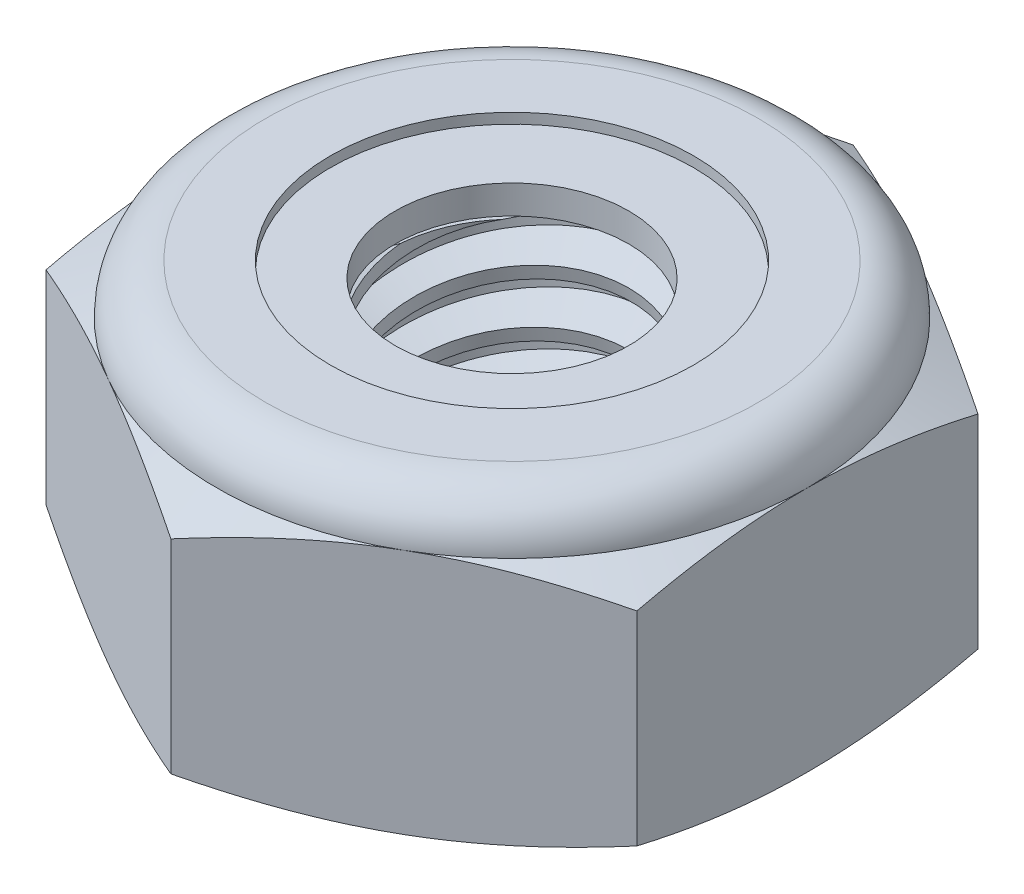
from build123d import *

# Parameters (mm, degrees)
EXTRUDE1_DEPTH       = 4.365625
SKETCH2_W            = 2.0828
SKETCH2_H            = 4.365625
LPATTERN1_COUNT      = 6
LPATTERN1_PITCH      = 0.79375
LPATTERN1_COUNT_DIR2 = 2
LPATTERN1_PITCH_DIR2 = 0.79375


with BuildPart() as part:
    # Sketch1 → Extrude1 (new body)
    with BuildSketch(Plane(origin=(0, 0, 0), x_dir=(1, 0, 0), z_dir=(0, 1, 0))):
        Polygon((0, 5.040989538), (-4.365625, 2.520494769), (-4.365625, -2.520494769), (0, -5.040989538), (4.365625, -2.520494769), (4.365625, 2.520494769), align=None)
    extrude(amount=EXTRUDE1_DEPTH)

    # Sketch4 → Cut-Revolve2 (revolve, cut)
    with BuildSketch(Plane(origin=(0, 0, 0), x_dir=(0, 0, -1), z_dir=(1, 0, 0))):
        Polygon((0, 4.365625), (2.0828, 4.365625), (1.725765218, 4.199136947), (1.725765218, 0.166488053), (2.0828, 0), (0, 0), align=None)
    revolve(axis=Axis((0, 4.365625, 0), (0, 1, 0)), mode=Mode.SUBTRACT)


with BuildPart() as body_2:
    # Sketch2 → Revolve1 (revolve)
    with BuildSketch(Plane(origin=(0, 0, 0), x_dir=(0, 0, -1), z_dir=(1, 0, 0))):
        with Locations((1.0414, 2.1828125)):
            Rectangle(SKETCH2_W, SKETCH2_H)
    revolve(axis=Axis((0, -2.0828, 0), (0, 1, 0)))

    # Sketch3 → Cut-Revolve1 (revolve, cut)
    with BuildSketch(Plane(origin=(0, 0, 0), x_dir=(0, 0, -1), z_dir=(1, 0, 0))):
        Polygon((2.101371857, 4.268159896), (2.231374854, 3.585904168), (1.762908932, 3.74914843), (1.725765218, 3.944078638), align=None)
    cut_revolve1 = revolve(axis=Axis((0, 4.365625, 0.162231854), (0, -0.9823254572523517, -0.18718091792156105)), mode=Mode.SUBTRACT)

    # LPattern1: Cut-Revolve1 6 × 2
    with Locations(*[Vector(0, -1, 0) * (i * LPATTERN1_PITCH) + Vector(0, 1, 0) * (j * LPATTERN1_PITCH_DIR2) for i in range(LPATTERN1_COUNT) for j in range(LPATTERN1_COUNT_DIR2) if (i, j) != (0, 0)]):
        add(cut_revolve1, mode=Mode.SUBTRACT)


with BuildPart() as part_1:
    add(part.part)

    # Combine1: cut body 2
    add(body_2.part, mode=Mode.SUBTRACT)

    # Sketch5 → Cut-Revolve3 (revolve, cut)
    with BuildSketch(Plane(origin=(0, 0, 0), x_dir=(0, 0, -1), z_dir=(1, 0, 0))):
        with BuildLine():
            Line((0, 0), (4.365625, 0))
            Line((4.365625, 0), (5.040989538, 0.314927656))
            Line((5.040989538, 0.314927656), (5.040989538, 3.323093177))
            Line((5.040989538, 3.323093177), (4.365625, 3.638020833))
            ThreePointArc((4.365625, 3.638020833), (4.152514674, 4.152514674), (3.638020833, 4.365625))
            Line((3.638020833, 4.365625), (3.638020833, 5.635625))
            Line((3.638020833, 5.635625), (6.310989538, 5.635625))
            Line((6.310989538, 5.635625), (6.310989538, -1.27))
            Line((6.310989538, -1.27), (0, -1.27))
            Line((0, -1.27), (0, 0))
        make_face()
    revolve(axis=Axis((0, 0, 0), (0, 1, 0)), mode=Mode.SUBTRACT)

    # Sketch6 → Cut-Revolve4 (revolve, cut)
    with BuildSketch(Plane(origin=(0, 0, 0), x_dir=(0, 0, -1), z_dir=(1, 0, 0))):
        with BuildLine():
            Line((0, 3.638020833), (4.213225, 3.638020833))
            ThreePointArc((4.213225, 3.638020833), (4.0447516, 4.0447516), (3.638020833, 4.213225))
            Line((3.638020833, 4.213225), (2.681893026, 4.213225))
            Line((2.681893026, 4.213225), (2.681893026, 5.635625))
            Line((2.681893026, 5.635625), (0, 5.635625))
            Line((0, 5.635625), (0, 3.638020833))
        make_face()
    revolve(axis=Axis((0, 5.635625, 0), (0, 1, 0)), mode=Mode.SUBTRACT)


with BuildPart() as body_2_2:
    # Sketch7 → Revolve2 (revolve)
    with BuildSketch(Plane(origin=(0, 0, 0), x_dir=(0, 0, -1), z_dir=(1, 0, 0))):
        with BuildLine():
            Line((1.725765218, 3.714220833), (4.131172654, 3.714220833))
            ThreePointArc((4.131172654, 3.714220833), (3.962813876, 4.016854092), (3.638020833, 4.137025))
            Line((3.638020833, 4.137025), (1.725765218, 4.137025))
            Line((1.725765218, 4.137025), (1.725765218, 3.714220833))
        make_face()
    revolve(axis=Axis((0, 3.714220833, 0), (0, 1, 0)))


solid = Compound([part_1.part, body_2_2.part])
